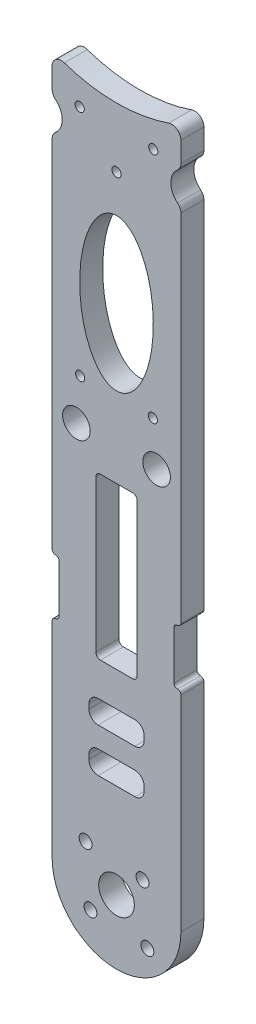
from build123d import *

# Parameters (mm, degrees)
SKETCH1_R           = 1
SKETCH1_R_2         = 1.4
SKETCH1_R_3         = 3
SKETCH1_RX          = 16.5
SKETCH1_RY          = 8
BOSS_EXTRUDE1_DEPTH = 5
CUT_EXTRUDE1_REACH  = 153.803
SKETCH2_R           = 3.875


with BuildPart() as part:
    # Sketch1 → Boss-Extrude1 (new body)
    with BuildSketch(Plane.XY):
        with BuildLine():
            Line((-14, 0), (-14, 44.641437436))
            ThreePointArc((-14, 44.641437436), (-13.783259018, 45.164696454), (-13.26, 45.381437436))
            Line((-13.26, 45.381437436), (-13.24, 45.381437436))
            ThreePointArc((-13.24, 45.381437436), (-12.716740982, 45.598178417), (-12.5, 46.121437436))
            Line((-12.5, 46.121437436), (-12.5, 56.641437436))
            ThreePointArc((-12.5, 56.641437436), (-12.716740982, 57.164696454), (-13.24, 57.381437436))
            Line((-13.24, 57.381437436), (-13.26, 57.381437436))
            ThreePointArc((-13.26, 57.381437436), (-13.783259018, 57.598178417), (-14, 58.121437436))
            Line((-14, 58.121437436), (-14, 135.347392982))
            ThreePointArc((-14, 135.347392982), (-13.809166738, 136.199986504), (-13.273084285, 136.889876824))
            ThreePointArc((-13.273084285, 136.889876824), (-11.805402668, 140.00423401), (-13.273084285, 143.118591196))
            ThreePointArc((-13.273084285, 143.118591196), (-13.809166738, 143.808481515), (-14, 144.661075038))
            Line((-14, 144.661075038), (-14, 149.07320666))
            ThreePointArc((-14, 149.07320666), (-13.162476387, 150.700673602), (-11.351351351, 150.965098552))
            ThreePointArc((-11.351351351, 150.965098552), (0, 149.07320666), (11.351351351, 150.965098552))
            ThreePointArc((11.351351351, 150.965098552), (13.162476387, 150.700673602), (14, 149.07320666))
            Line((14, 149.07320666), (14, 144.661075038))
            ThreePointArc((14, 144.661075038), (13.809166738, 143.808481515), (13.273084285, 143.118591196))
            ThreePointArc((13.273084285, 143.118591196), (11.805402668, 140.00423401), (13.273084285, 136.889876824))
            ThreePointArc((13.273084285, 136.889876824), (13.809166738, 136.199986504), (14, 135.347392982))
            Line((14, 135.347392982), (14, 58.121437436))
            ThreePointArc((14, 58.121437436), (13.783259018, 57.598178417), (13.26, 57.381437436))
            Line((13.26, 57.381437436), (13.24, 57.381437436))
            ThreePointArc((13.24, 57.381437436), (12.716740982, 57.164696454), (12.5, 56.641437436))
            Line((12.5, 56.641437436), (12.5, 46.121437436))
            ThreePointArc((12.5, 46.121437436), (12.716740982, 45.598178417), (13.24, 45.381437436))
            Line((13.24, 45.381437436), (13.26, 45.381437436))
            ThreePointArc((13.26, 45.381437436), (13.783259018, 45.164696454), (14, 44.641437436))
            Line((14, 44.641437436), (14, 0))
            ThreePointArc((14, 0), (0, -14), (-14, 0))
        make_face()
        with Locations((-8, 144.371191598)):
            Circle(SKETCH1_R, mode=Mode.SUBTRACT)
        with Locations((6.717514421, -6.717514421)):
            Circle(SKETCH1_R_2, mode=Mode.SUBTRACT)
        with Locations((-5.656854249, -5.656854249)):
            Circle(SKETCH1_R_2, mode=Mode.SUBTRACT)
        with Locations(Location((5.656854249, 5.656854249, 0), (0, 0, 180))):
            Circle(SKETCH1_R_2, mode=Mode.SUBTRACT)
        with Locations(Location((-6.717514421, 6.717514421, 0), (0, 0, 180))):
            Circle(SKETCH1_R_2, mode=Mode.SUBTRACT)
        with Locations(Location((8, 144.371191598, 0), (0, 0, 180))):
            Circle(SKETCH1_R, mode=Mode.SUBTRACT)
        with Locations((0, 136.07320666)):
            Circle(SKETCH1_R, mode=Mode.SUBTRACT)
        with Locations((7.903282752, 93.738271437)):
            Circle(SKETCH1_R, mode=Mode.SUBTRACT)
        with Locations((8.715574275, 84.453736851)):
            Circle(SKETCH1_R_3, mode=Mode.SUBTRACT)
        with Locations(Location((-7.903282752, 93.738271437, 0), (0, 0, 180))):
            Circle(SKETCH1_R, mode=Mode.SUBTRACT)
        with Locations(Location((-8.715574275, 84.453736851, 0), (0, 0, 180))):
            Circle(SKETCH1_R_3, mode=Mode.SUBTRACT)
        with Locations(Location((0, 111.383897204), (0, 0, 90))):
            Ellipse(SKETCH1_RX, SKETCH1_RY, mode=Mode.SUBTRACT)
        with BuildLine():
            Line((-4, 29.983897204), (4, 29.983897204))
            ThreePointArc((4, 29.983897204), (5.414213562, 30.569683642), (6, 31.983897204))
            Line((6, 31.983897204), (6, 32.983897204))
            ThreePointArc((6, 32.983897204), (5.414213562, 34.398110767), (4, 34.983897204))
            Line((4, 34.983897204), (-4, 34.983897204))
            ThreePointArc((-4, 34.983897204), (-5.414213562, 34.398110767), (-6, 32.983897204))
            Line((-6, 32.983897204), (-6, 31.983897204))
            ThreePointArc((-6, 31.983897204), (-5.414213562, 30.569683642), (-4, 29.983897204))
        make_face(mode=Mode.SUBTRACT)
        with BuildLine():
            Line((-4, 20.483897204), (4, 20.483897204))
            ThreePointArc((4, 20.483897204), (5.414213562, 21.069683642), (6, 22.483897204))
            Line((6, 22.483897204), (6, 23.483897204))
            ThreePointArc((6, 23.483897204), (5.414213562, 24.898110767), (4, 25.483897204))
            Line((4, 25.483897204), (-4, 25.483897204))
            ThreePointArc((-4, 25.483897204), (-5.414213562, 24.898110767), (-6, 23.483897204))
            Line((-6, 23.483897204), (-6, 22.483897204))
            ThreePointArc((-6, 22.483897204), (-5.414213562, 21.069683642), (-4, 20.483897204))
        make_face(mode=Mode.SUBTRACT)
        with BuildLine():
            Line((-3.5, 42.443937436), (3.5, 42.443937436))
            ThreePointArc((3.5, 42.443937436), (4.207106781, 42.736830654), (4.5, 43.443937436))
            Line((4.5, 43.443937436), (4.5, 76.443937436))
            ThreePointArc((4.5, 76.443937436), (4.207106781, 77.151044217), (3.5, 77.443937436))
            Line((3.5, 77.443937436), (-3.5, 77.443937436))
            ThreePointArc((-3.5, 77.443937436), (-4.207106781, 77.151044217), (-4.5, 76.443937436))
            Line((-4.5, 76.443937436), (-4.5, 43.443937436))
            ThreePointArc((-4.5, 43.443937436), (-4.207106781, 42.736830654), (-3.5, 42.443937436))
        make_face(mode=Mode.SUBTRACT)
    extrude(amount=BOSS_EXTRUDE1_DEPTH)

    # Sketch2 → Cut-Extrude1 (cut, up to next)
    with BuildSketch(Plane.XY.offset(5), mode=Mode.PRIVATE) as cut_extrude1_sk1:
        Circle(SKETCH2_R)
    cut_extrude1_tool1 = extrude(cut_extrude1_sk1.sketch, amount=-CUT_EXTRUDE1_REACH, mode=Mode.PRIVATE) & part.part
    add(cut_extrude1_tool1.solids().sort_by_distance((0, 0, 5))[0], mode=Mode.SUBTRACT)


solid = part.part
